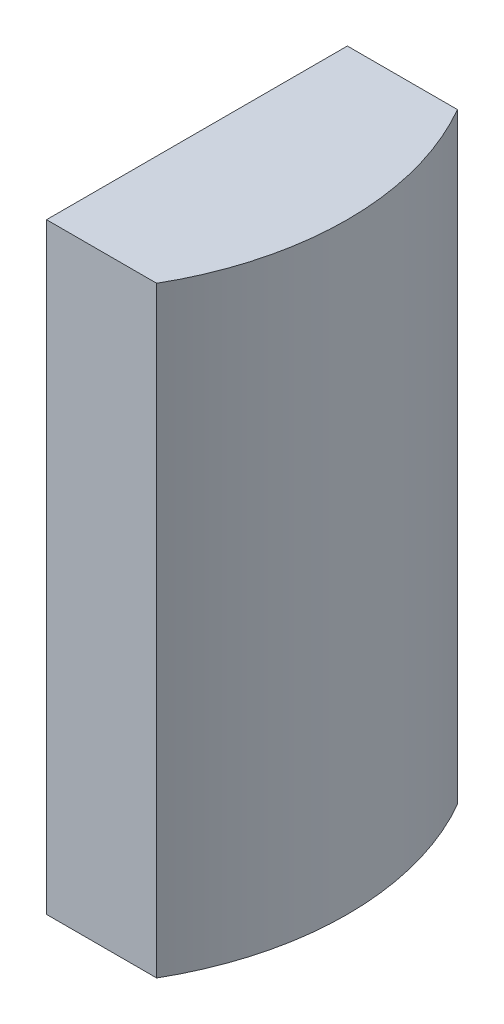
from build123d import *

# Parameters (mm, degrees)
EXTRUDE_1_DEPTH = 4


with BuildPart() as part:
    # Эскиз1 → Бобышка-Вытянуть1 (new body)
    with BuildSketch(Plane(origin=(0, 0, 0), x_dir=(1, 0, 0), z_dir=(0, 1, 0))):
        with BuildLine():
            Line((1.001220297, 2), (1.733272779, 2))
            ThreePointArc((1.733272779, 2), (2.001058352, 1), (1.733272779, 0))
            Line((1.733272779, 0), (1.001220297, 0))
            Line((1.001220297, 0), (1.001220297, 2))
        make_face()
    extrude(amount=EXTRUDE_1_DEPTH)


solid = part.part
